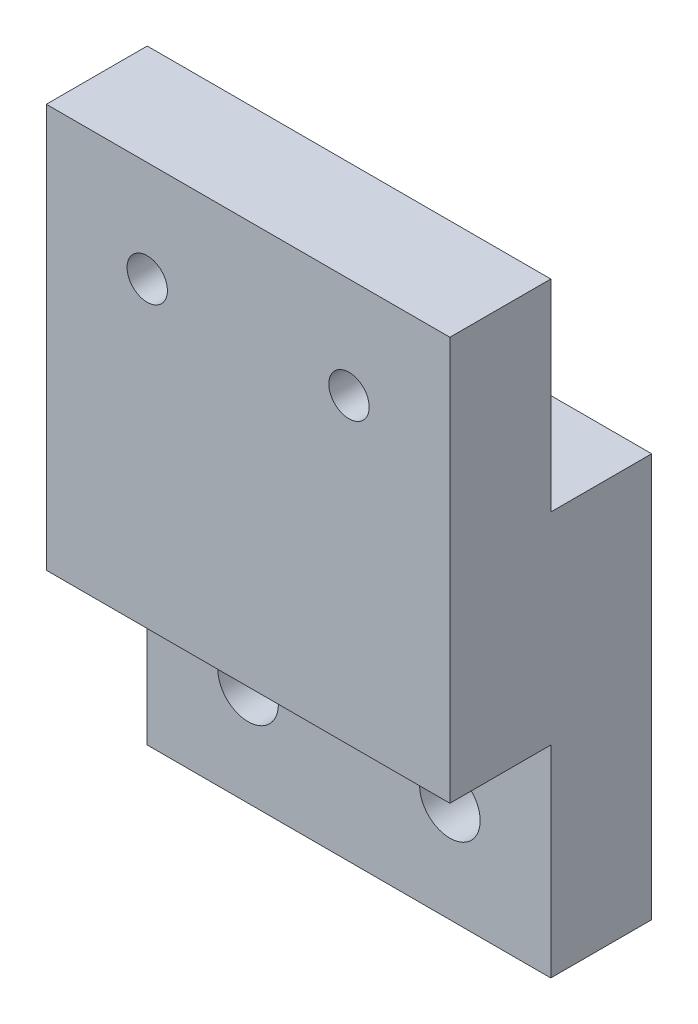
from build123d import *

# Parameters (mm, degrees)
SKETCH1_W           = 20
SKETCH1_H           = 10
BOSS_EXTRUDE1_DEPTH = 5
SKETCH2_W           = 20
SKETCH2_H           = 5
BOSS_EXTRUDE2_DEPTH = 10
SKETCH3_W           = 20
SKETCH3_H           = 10
BOSS_EXTRUDE3_DEPTH = 5
SKETCH5_R           = 1
CUT_EXTRUDE1_DEPTH  = 10
SKETCH7_W           = 20
SKETCH7_H           = 5
BOSS_EXTRUDE5_DEPTH = 10
SKETCH8_R           = 1.5
CUT_EXTRUDE3_DEPTH  = 10


with BuildPart() as part:
    # Sketch1 → Boss-Extrude1 (new body)
    with BuildSketch(Plane.XY):
        Rectangle(SKETCH1_W, SKETCH1_H)
    extrude(amount=BOSS_EXTRUDE1_DEPTH)

    # Sketch2 → Boss-Extrude2 (add)
    with BuildSketch(Plane.XZ.offset(5)):
        with Locations((0, 2.5)):
            Rectangle(SKETCH2_W, SKETCH2_H)
    extrude(amount=BOSS_EXTRUDE2_DEPTH)

    # Sketch3 → Boss-Extrude3 (add)
    with BuildSketch(Plane(origin=(0, 0, 0), x_dir=(-1, 0, 0), z_dir=(0, 0, -1))):
        with Locations((0, -10)):
            Rectangle(SKETCH3_W, SKETCH3_H)
    extrude(amount=BOSS_EXTRUDE3_DEPTH)

    # Sketch5 → Cut-Extrude1 (cut)
    with BuildSketch(Plane.XY.offset(5)):
        with Locations((-5, 0)):
            Circle(SKETCH5_R)
        with Locations((5, 0)):
            Circle(SKETCH5_R)
    extrude(amount=-CUT_EXTRUDE1_DEPTH, mode=Mode.SUBTRACT)

    # Sketch7 → Boss-Extrude5 (add)
    with BuildSketch(Plane.XZ.offset(15)):
        with Locations((0, -2.5)):
            Rectangle(SKETCH7_W, SKETCH7_H)
    extrude(amount=BOSS_EXTRUDE5_DEPTH)

    # Sketch8 → Cut-Extrude3 (cut)
    with BuildSketch(Plane.XY):
        with Locations((-5, -20)):
            Circle(SKETCH8_R)
        with Locations((5, -20)):
            Circle(SKETCH8_R)
    extrude(amount=-CUT_EXTRUDE3_DEPTH, mode=Mode.SUBTRACT)


solid = part.part
